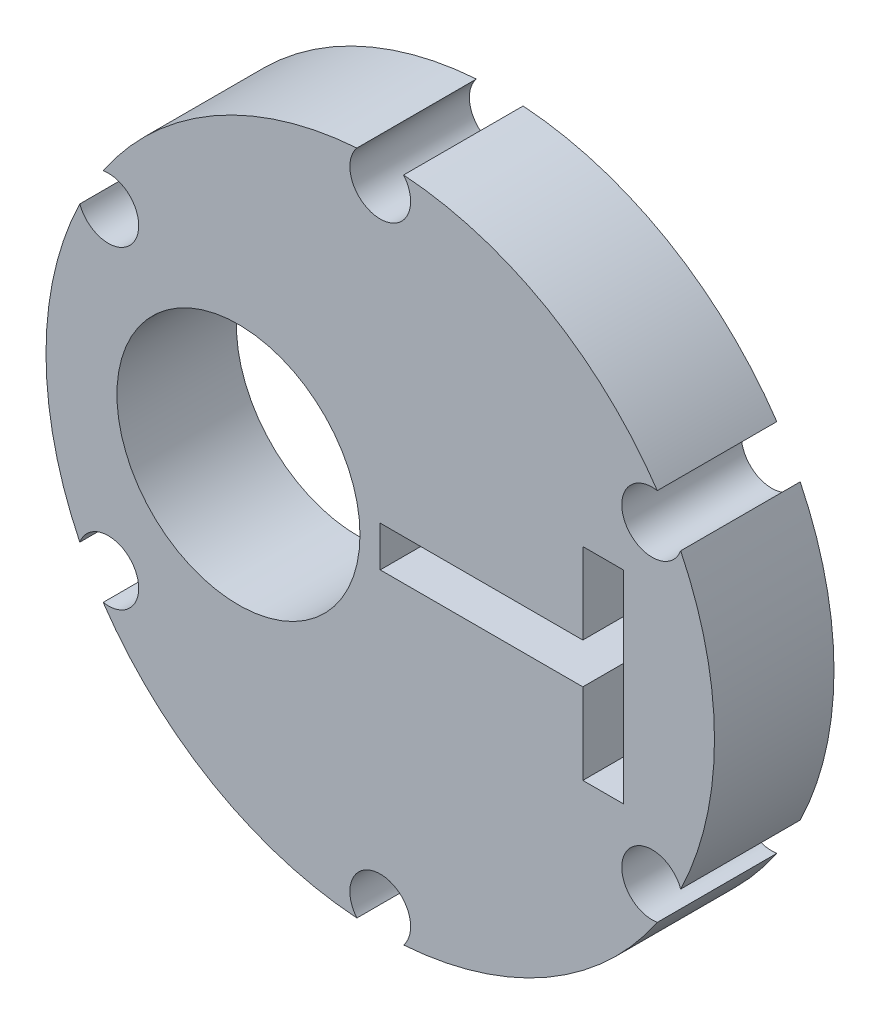
from build123d import *

# Parameters (mm, degrees)
SKETCH1_R           = 16.5
BOSS_EXTRUDE1_DEPTH = 5.9
SKETCH2_R           = 1.5
CUT_EXTRUDE1_DEPTH  = 25.068859549
SKETCH3_R           = 6
CUT_EXTRUDE2_DEPTH  = 25.041235009
CUT_EXTRUDE3_DEPTH  = 25.041235009


with BuildPart() as part:
    # Sketch1 → Boss-Extrude1 (new body)
    with BuildSketch(Plane.XY):
        Circle(SKETCH1_R)
    extrude(amount=BOSS_EXTRUDE1_DEPTH)

    # Sketch2 → Cut-Extrude1 (cut, through all)
    with BuildSketch(Plane.XY.offset(5.9)):
        with Locations((0, 15.5)):
            Circle(SKETCH2_R)
        with Locations((13.423393759, 7.75)):
            Circle(SKETCH2_R)
        with Locations((13.423393759, -7.75)):
            Circle(SKETCH2_R)
        with Locations((0, -15.5)):
            Circle(SKETCH2_R)
        with Locations((-13.423393759, -7.75)):
            Circle(SKETCH2_R)
        with Locations((-13.423393759, 7.75)):
            Circle(SKETCH2_R)
    extrude(amount=-CUT_EXTRUDE1_DEPTH, mode=Mode.SUBTRACT)

    # Sketch3 → Cut-Extrude2 (cut, through all)
    with BuildSketch(Plane.XY.offset(5.9)):
        with Locations((-7, 0)):
            Circle(SKETCH3_R)
    extrude(amount=-CUT_EXTRUDE2_DEPTH, mode=Mode.SUBTRACT)

    # Sketch5 → Cut-Extrude3 (cut, through all)
    with BuildSketch(Plane.XY.offset(5.9)):
        Polygon((12, 5), (10, 5), (10, 1), (0, 1), (0, -1), (10, -1), (10, -5), (12, -5), align=None)
    extrude(amount=-CUT_EXTRUDE3_DEPTH, mode=Mode.SUBTRACT)


solid = part.part
